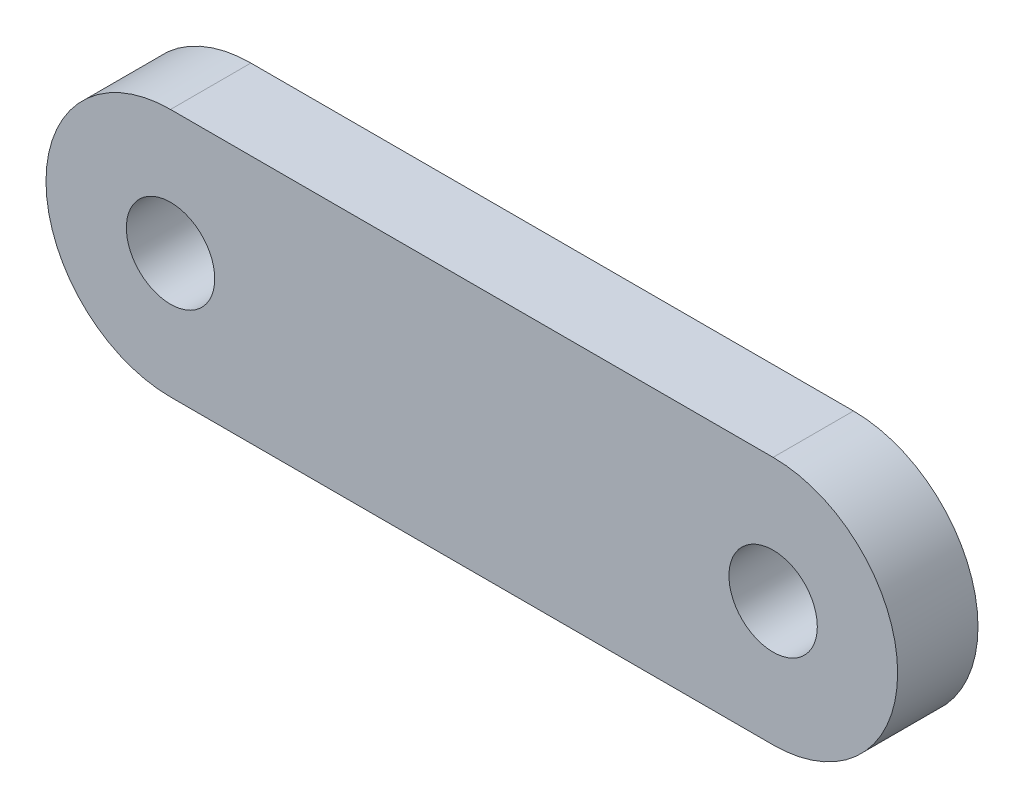
from build123d import *

# Parameters (mm, degrees)
EXTRUDE_1_DEPTH = 3


with BuildPart() as part:
    # Эскиз1 → Бобышка-Вытянуть1 (new body)
    with BuildSketch(Plane.XY):
        with BuildLine():
            ThreePointArc((-6.6, 0), (-7.961953467, -3.288046533), (-11.25, -4.65))
            Line((-11.25, -4.65), (11.25, -4.65))
            ThreePointArc((11.25, -4.65), (6.6, 0), (11.25, 4.65))
            Line((11.25, 4.65), (-11.25, 4.65))
            ThreePointArc((-11.25, 4.65), (-7.961953467, 3.288046533), (-6.6, 0))
        make_face()
        with BuildLine():
            ThreePointArc((11.25, 4.65), (6.6, 0), (11.25, -4.65))
            Line((11.25, -4.65), (11.25, -1.65))
            ThreePointArc((11.25, -1.65), (9.6, 0), (11.25, 1.65))
            Line((11.25, 1.65), (11.25, 4.65))
        make_face()
        with BuildLine():
            Line((11.25, -1.65), (11.25, -4.65))
            ThreePointArc((11.25, -4.65), (14.538046533, -3.288046533), (15.9, 0))
            ThreePointArc((15.9, 0), (14.538046533, 3.288046533), (11.25, 4.65))
            Line((11.25, 4.65), (11.25, 1.65))
            ThreePointArc((11.25, 1.65), (12.416726189, 1.166726189), (12.9, 0))
            ThreePointArc((12.9, 0), (12.416726189, -1.166726189), (11.25, -1.65))
        make_face()
        with BuildLine():
            ThreePointArc((-11.25, 4.65), (-15.9, 0), (-11.25, -4.65))
            Line((-11.25, -4.65), (-11.25, -1.65))
            ThreePointArc((-11.25, -1.65), (-12.9, 0), (-11.25, 1.65))
            Line((-11.25, 1.65), (-11.25, 4.65))
        make_face()
        with BuildLine():
            Line((-11.25, -1.65), (-11.25, -4.65))
            ThreePointArc((-11.25, -4.65), (-7.961953467, -3.288046533), (-6.6, 0))
            ThreePointArc((-6.6, 0), (-7.961953467, 3.288046533), (-11.25, 4.65))
            Line((-11.25, 4.65), (-11.25, 1.65))
            ThreePointArc((-11.25, 1.65), (-10.083273811, 1.166726189), (-9.6, 0))
            ThreePointArc((-9.6, 0), (-10.083273811, -1.166726189), (-11.25, -1.65))
        make_face()
    extrude(amount=EXTRUDE_1_DEPTH)


solid = part.part
